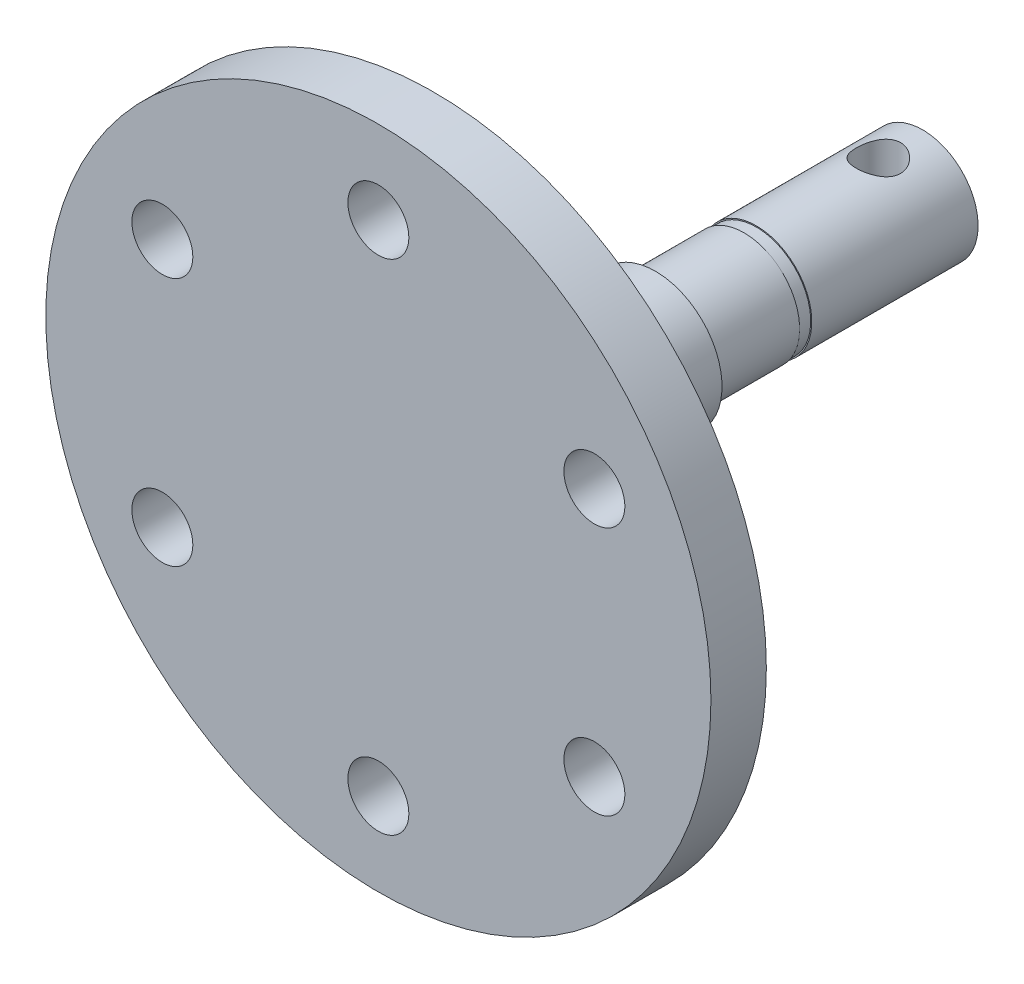
from build123d import *

# Parameters (mm, degrees)
SKETCH_1_R               = 30
SKETCH_1_R_2             = 2.75
EXTRUDE_1_DEPTH          = 5
SKETCH_2_R               = 12
EXTRUDE_2_DEPTH          = 10
SKETCH_3_R               = 6
EXTRUDE_3_DEPTH          = 10
SKETCH_4_R               = 5
EXTRUDE_4_DEPTH          = 8
SKETCH_5_R               = 4.9
EXTRUDE_5_DEPTH          = 1.1
SKETCH_6_R               = 5
EXTRUDE_6_DEPTH          = 15
CUT_EXTRUDE_1_DEPTH      = 15
CUT_EXTRUDE_1_DEPTH_BACK = 15
SKETCH_7_R               = 2


with BuildPart() as part:
    # 草图1 → 凸台-拉伸1 (new body)
    with BuildSketch(Plane.XY):
        Circle(SKETCH_1_R)
        with Locations((0, 22.5)):
            Circle(SKETCH_1_R_2, mode=Mode.SUBTRACT)
        with Locations((19.485571585, 11.25)):
            Circle(SKETCH_1_R_2, mode=Mode.SUBTRACT)
        with Locations((19.485571585, -11.25)):
            Circle(SKETCH_1_R_2, mode=Mode.SUBTRACT)
        with Locations((0, -22.5)):
            Circle(SKETCH_1_R_2, mode=Mode.SUBTRACT)
        with Locations((-19.485571585, -11.25)):
            Circle(SKETCH_1_R_2, mode=Mode.SUBTRACT)
        with Locations((-19.485571585, 11.25)):
            Circle(SKETCH_1_R_2, mode=Mode.SUBTRACT)
    extrude(amount=EXTRUDE_1_DEPTH)

    # 草图2 → 凸台-拉伸2 (add)
    with BuildSketch(Plane(origin=(0, 0, 0), x_dir=(-1, 0, 0), z_dir=(0, 0, -1))):
        Circle(SKETCH_2_R)
    extrude(amount=EXTRUDE_2_DEPTH)

    # 草图3 → 凸台-拉伸3 (add)
    with BuildSketch(Plane(origin=(0, 0, -10), x_dir=(-1, 0, 0), z_dir=(0, 0, -1))):
        Circle(SKETCH_3_R)
    extrude(amount=EXTRUDE_3_DEPTH)

    # 草图4 → 凸台-拉伸4 (add)
    with BuildSketch(Plane(origin=(0, 0, -20), x_dir=(-1, 0, 0), z_dir=(0, 0, -1))):
        Circle(SKETCH_4_R)
    extrude(amount=EXTRUDE_4_DEPTH)

    # 草图5 → 凸台-拉伸5 (add)
    with BuildSketch(Plane(origin=(0, 0, -28), x_dir=(-1, 0, 0), z_dir=(0, 0, -1))):
        Circle(SKETCH_5_R)
    extrude(amount=EXTRUDE_5_DEPTH)

    # 草图6 → 凸台-拉伸6 (add)
    with BuildSketch(Plane(origin=(0, 0, -29.1), x_dir=(-1, 0, 0), z_dir=(0, 0, -1))):
        Circle(SKETCH_6_R)
    extrude(amount=EXTRUDE_6_DEPTH)

    # 草图7 → 切除-拉伸1 (cut, two sides: drawn at the far end of the back side and taken through both)
    with BuildSketch(Plane(origin=(0, 0, 0), x_dir=(1, 0, 0), z_dir=(0, 1, 0)).offset(-CUT_EXTRUDE_1_DEPTH_BACK)):
        with Locations((0, 40.1)):
            Circle(SKETCH_7_R)
    extrude(amount=CUT_EXTRUDE_1_DEPTH + CUT_EXTRUDE_1_DEPTH_BACK, mode=Mode.SUBTRACT)


solid = part.part
